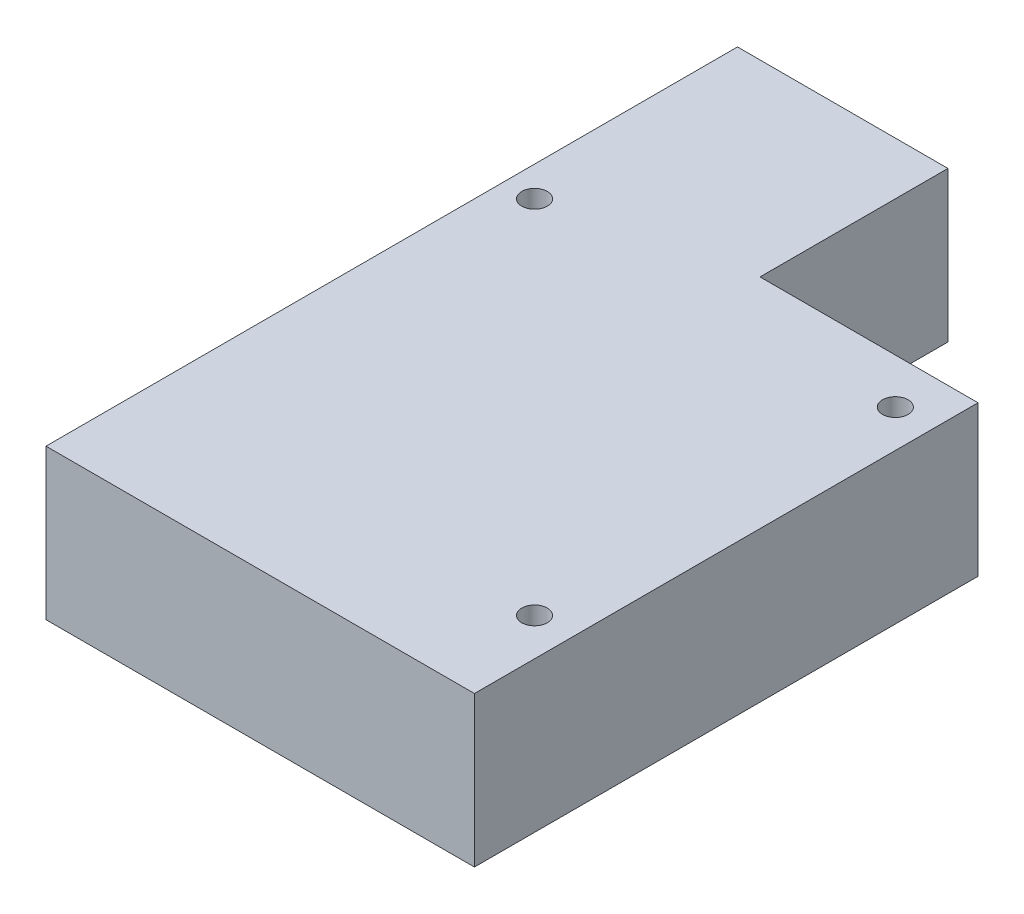
from build123d import *

# Parameters (mm, degrees)
SKETCH1_W           = 57
SKETCH1_H           = 67
BOSS_EXTRUDE1_DEPTH = 20
SKETCH2_R           = 1.7
CUT_EXTRUDE1_DEPTH  = 20
SKETCH3_W           = 28
SKETCH3_H           = 20
BOSS_EXTRUDE2_DEPTH = 25


with BuildPart() as part:
    # Sketch1 → Boss-Extrude1 (new body)
    with BuildSketch(Plane(origin=(0, 0, 0), x_dir=(1, 0, 0), z_dir=(0, 1, 0))):
        Rectangle(SKETCH1_W, SKETCH1_H)
    extrude(amount=BOSS_EXTRUDE1_DEPTH)

    # Sketch2 → Cut-Extrude1 (cut)
    with BuildSketch(Plane(origin=(0, 20, 0), x_dir=(1, 0, 0), z_dir=(0, 1, 0))):
        with Locations(Location((-24.5, 27.5, 0), (0, 0, 270))):
            Circle(SKETCH2_R)
        with Locations(Location((23.5, 27.5, 0), (0, 0, 270))):
            Circle(SKETCH2_R)
        with Locations(Location((23.5, -20.5, 0), (0, 0, 270))):
            Circle(SKETCH2_R)
    extrude(amount=-CUT_EXTRUDE1_DEPTH, mode=Mode.SUBTRACT)

    # Sketch3 → Boss-Extrude2 (add)
    with BuildSketch(Plane(origin=(0, 0, -33.5), x_dir=(-1, 0, 0), z_dir=(0, 0, -1))):
        with Locations((14.5, 10)):
            Rectangle(SKETCH3_W, SKETCH3_H)
    extrude(amount=BOSS_EXTRUDE2_DEPTH)


solid = part.part
